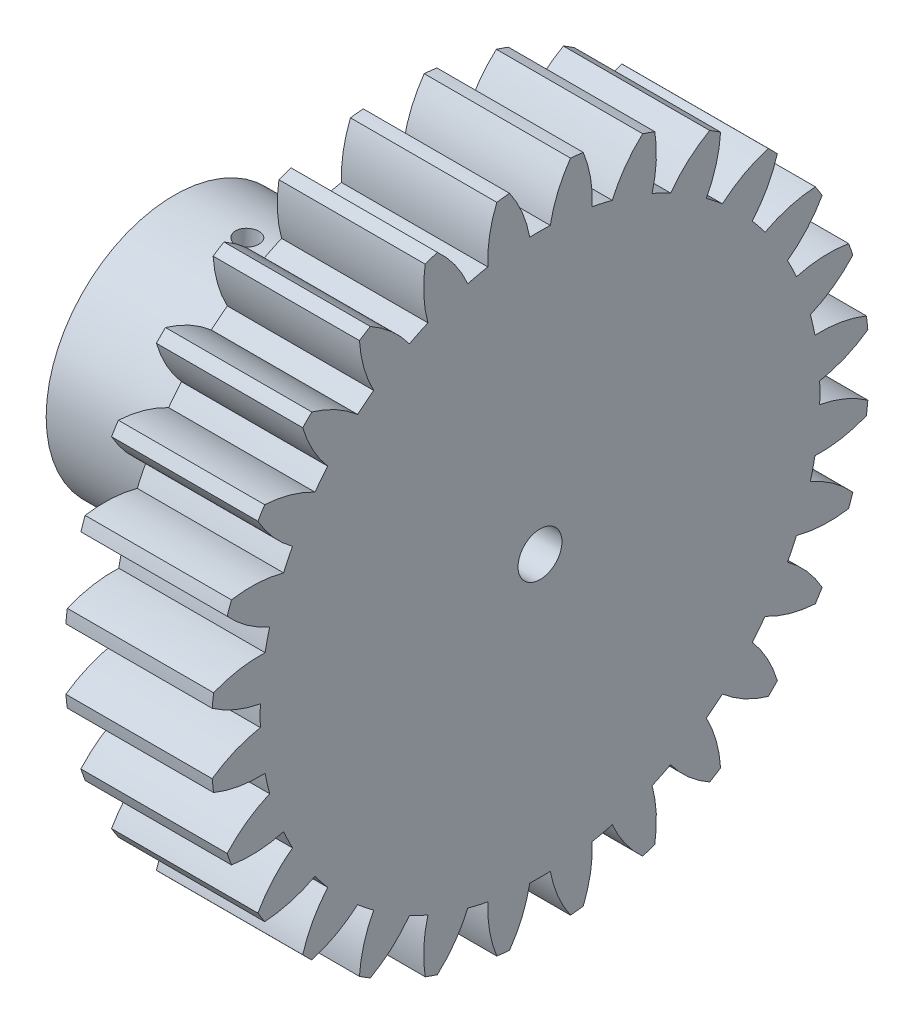
from build123d import *

# Parameters (mm, degrees)
BASPROSKE_W           = 20
BASPROSKE_H           = 45
TOOTHCUT_DEPTH        = 67.708320321
TEETHCUTS_COUNT       = 28
TEETHCUTS_ANGLE       = 347.142857143
HUBNEAONESKE_R        = 17.5
HUBNEARONE_DEPTH      = 30.0000508
BORSKE_R              = 3
BORE_DEPTH            = 50.0000508
CROQUIS1_R            = 1.59
CORTAR_EXTRUIR1_DEPTH = 25
CROQUIS2_W            = 6
CROQUIS2_H            = 3.5
CORTAR_EXTRUIR2_DEPTH = 26


with BuildPart() as part:
    # BasProSke → Base-Revolve (revolve)
    with BuildSketch(Plane(origin=(0, 0, 0), x_dir=(1, 0, 0), z_dir=(0, 1, 0)), mode=Mode.PRIVATE) as base_revolve_sk:
        with Locations((10, 22.5)):
            Rectangle(BASPROSKE_W, BASPROSKE_H)
    revolve(base_revolve_sk.sketch.rotate(Axis((-10, 0, 0), (1, 0, 0)), 180), axis=Axis((-10, 0, 0), (1, 0, 0)))

    # TooCutSke → ToothCut (cut, through all)
    with BuildSketch(Plane(origin=(0, 0, 0), x_dir=(0, 0, -1), z_dir=(1, 0, 0))):
        with BuildLine():
            ThreePointArc((1.403213633, 38.223251988), (0, 38.249), (-1.403213633, 38.223251988))
            ThreePointArc((-1.403213633, 38.223251988), (-2.43634991, 41.67694432), (-4.182509757, 44.830717787))
            ThreePointArc((-4.182509757, 44.830717787), (0, 45.0254), (4.182509757, 44.830717787))
            ThreePointArc((4.182509757, 44.830717787), (2.43634991, 41.67694432), (1.403213633, 38.223251988))
        make_face()
    toothcut = extrude(amount=TOOTHCUT_DEPTH, mode=Mode.SUBTRACT)

    # TeethCuts: ToothCut ×28 about axis
    teethcuts_axis = Axis((-10, 0, 0), (1, 0, 0))
    for i in range(1, TEETHCUTS_COUNT):
        add(toothcut.rotate(teethcuts_axis, i * TEETHCUTS_ANGLE / (TEETHCUTS_COUNT - 1)), mode=Mode.SUBTRACT)

    # HubNeaOneSke → HubNearOne (add)
    with BuildSketch(Plane.ZY):
        with Locations(Location((0, 0, 0), (0, 0, 180))):
            Circle(HUBNEAONESKE_R)
    extrude(amount=HUBNEARONE_DEPTH)

    # BorSke → Bore (cut, symmetric)
    with BuildSketch(Plane(origin=(0, 0, 0), x_dir=(0, 0, -1), z_dir=(1, 0, 0))):
        with Locations(Location((0, 0, 0), (0, 0, 180))):
            Circle(BORSKE_R)
    extrude(amount=BORE_DEPTH, both=True, mode=Mode.SUBTRACT)

    # Croquis1 → Cortar-Extruir1 (cut, symmetric)
    with BuildSketch(Plane(origin=(0, 0, 0), x_dir=(1, 0, 0), z_dir=(0, 1, 0))):
        with Locations(Location((-12.0000508, 0, 0), (0, 0, 270))):
            Circle(CROQUIS1_R)
        with Locations(Location((-20.0000508, 0, 0), (0, 0, 270))):
            Circle(CROQUIS1_R)
    extrude(amount=CORTAR_EXTRUIR1_DEPTH, both=True, mode=Mode.SUBTRACT)

    # Croquis2 → Cortar-Extruir2 (cut)
    with BuildSketch(Plane.ZY.offset(30.0000508)):
        with Locations((0, 8.75)):
            Rectangle(CROQUIS2_W, CROQUIS2_H)
        with Locations((0, -8.75)):
            Rectangle(CROQUIS2_W, CROQUIS2_H)
    extrude(amount=-CORTAR_EXTRUIR2_DEPTH, mode=Mode.SUBTRACT)


solid = part.part
